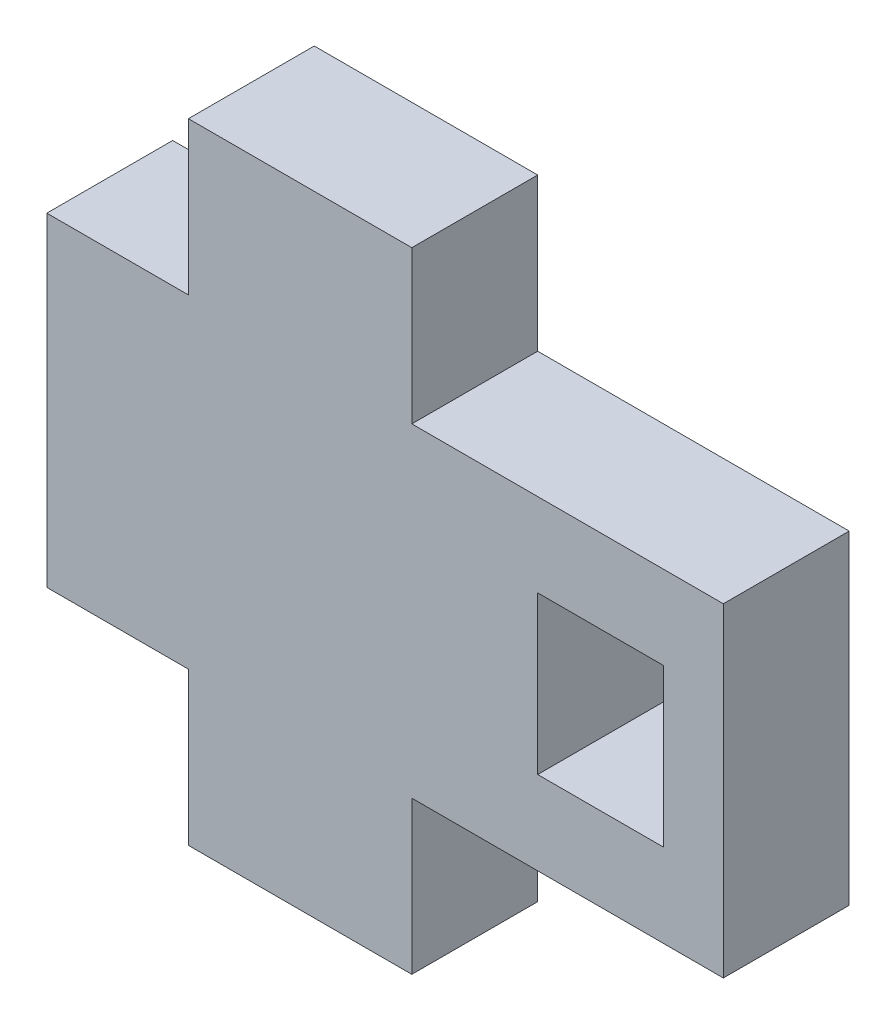
from build123d import *

# Parameters (mm, degrees)
SKETCH_1_W      = 4
SKETCH_1_H      = 5
EXTRUDE_1_DEPTH = 2


with BuildPart() as part:
    # 草图1 → 凸台-拉伸1 (new, symmetric)
    with BuildSketch(Plane.XY):
        Polygon((0, 15.15), (0, 20), (7.1, 20), (7.1, 15.15), (12.1, 15.15), (17, 15.15), (17, 4.85), (12.1, 4.85), (7.1, 4.85), (7.1, 0), (0, 0), (0, 4.85), (-4.5, 4.85), (-4.5, 15.15), align=None)
        with Locations((13.1, 10)):
            Rectangle(SKETCH_1_W, SKETCH_1_H, mode=Mode.SUBTRACT)
    extrude(amount=EXTRUDE_1_DEPTH, both=True)


solid = part.part
